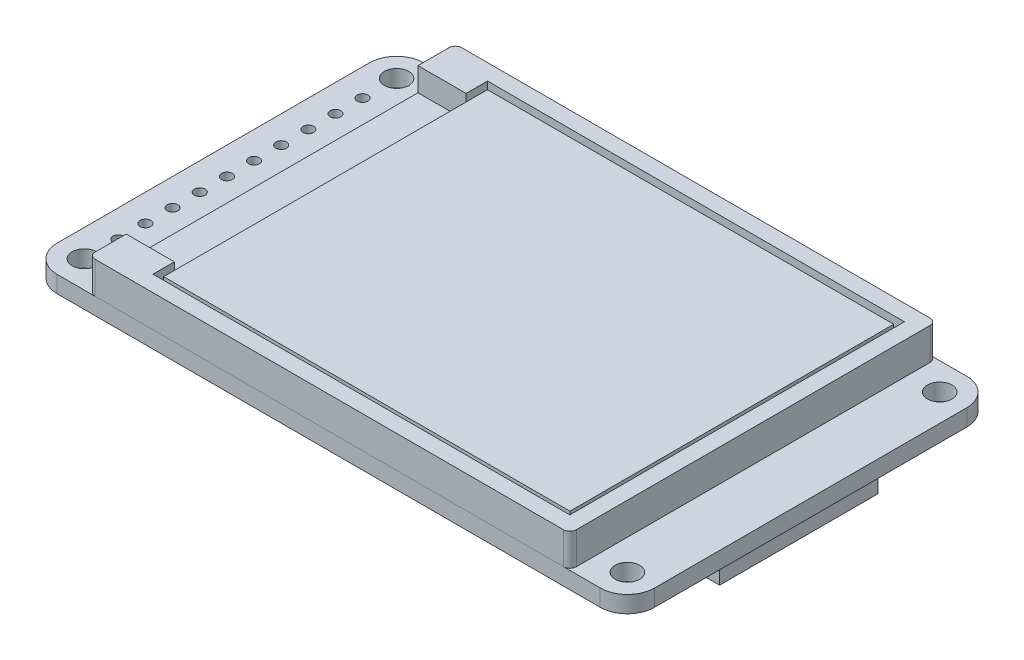
from build123d import *

# Parameters (mm, degrees)
SKETCH1_W                                     = 55.88
SKETCH1_H                                     = 34.29
CIRCUIT_BOARD_DEPTH                           = 1.57
FILLET1_R                                     = 2.54
SKETCH2_R                                     = 1.143
CUT_EXTRUDE1_DEPTH                            = 66.580815792
SKETCH3_R                                     = 0.5
CUT_EXTRUDE2_DEPTH                            = 66.580815792
CONNECTOR_HOLES_COUNT                         = 10
CONNECTOR_HOLES_PITCH                         = 2.54
SKETCH4_W                                     = 7.083224401
SKETCH4_H                                     = 9.821277531
SKETCH4_W_2                                   = 14.273419681
SKETCH4_H_2                                   = 14.821200637
IC1_AND_SD_CARD_SLOT_APPROXIMATE_SIZE_A_DEPTH = 2
SKETCH5_W                                     = 45
SKETCH5_H                                     = 34.29
BOSS_EXTRUDE3_DEPTH                           = 3
CUT_EXTRUDE3_DEPTH                            = 2.2
SKETCH7_W                                     = 38
SKETCH7_H                                     = 30.29
BOSS_EXTRUDE4_DEPTH                           = 2
FILLET2_R                                     = 0.6


with BuildPart() as part:
    # Sketch1 → Circuit Board (new body)
    with BuildSketch(Plane(origin=(0, 0, 0), x_dir=(1, 0, 0), z_dir=(0, 1, 0))):
        with Locations((27.94, 17.145)):
            Rectangle(SKETCH1_W, SKETCH1_H)
    extrude(amount=CIRCUIT_BOARD_DEPTH)

    # Fillet1
    fillet1_edges = [part.edges().sort_by_distance(p)[0] for p in [
        (0, 0.785, -34.29),
        (55.88, 0.785, -34.29),
        (55.88, 0.785, 0),
        (0, 0.785, 0),
    ]]
    fillet(fillet1_edges, radius=FILLET1_R)

    # Sketch2 → Cut-Extrude1 (cut, through all)
    with BuildSketch(Plane(origin=(0, 1.57, 0), x_dir=(1, 0, 0), z_dir=(0, 1, 0))):
        with Locations(Location((2.54, 31.75, 0), (0, 0, 270))):
            Circle(SKETCH2_R)
        with Locations(Location((53.34, 31.75, 0), (0, 0, 270))):
            Circle(SKETCH2_R)
        with Locations(Location((53.34, 2.54, 0), (0, 0, 270))):
            Circle(SKETCH2_R)
        with Locations(Location((2.54, 2.54, 0), (0, 0, 270))):
            Circle(SKETCH2_R)
    extrude(amount=-CUT_EXTRUDE1_DEPTH, mode=Mode.SUBTRACT)

    # Sketch3 → Cut-Extrude2 (cut, through all)
    with BuildSketch(Plane(origin=(0, 1.57, 0), x_dir=(1, 0, 0), z_dir=(0, 1, 0))):
        with Locations(Location((2.54, 5.715, 0), (0, 0, 270))):
            Circle(SKETCH3_R)
    cut_extrude2 = extrude(amount=-CUT_EXTRUDE2_DEPTH, mode=Mode.SUBTRACT)

    # Connector Holes: Cut-Extrude2 ×10
    with Locations(*[(0, 0, -i * CONNECTOR_HOLES_PITCH) for i in range(1, CONNECTOR_HOLES_COUNT)]):
        add(cut_extrude2, mode=Mode.SUBTRACT)

    # Sketch4 → IC1 and SD card slot (approximate size and location) (add)
    with BuildSketch(Plane.XZ):
        with Locations((19.457987587, -17.502137365)):
            Rectangle(SKETCH4_W, SKETCH4_H)
        with Locations((47.993177866, -16.787862636)):
            Rectangle(SKETCH4_W_2, SKETCH4_H_2)
    extrude(amount=IC1_AND_SD_CARD_SLOT_APPROXIMATE_SIZE_A_DEPTH)


with BuildPart() as body_2:
    # Sketch5 → Boss-Extrude3 (new body)
    with BuildSketch(Plane(origin=(0, 1.57, 0), x_dir=(1, 0, 0), z_dir=(0, 1, 0))):
        with Locations((28, 17.145)):
            Rectangle(SKETCH5_W, SKETCH5_H)
    extrude(amount=BOSS_EXTRUDE3_DEPTH)

    # Sketch6 → Cut-Extrude3 (cut)
    with BuildSketch(Plane(origin=(0, 4.57, 0), x_dir=(1, 0, 0), z_dir=(0, 1, 0))):
        Polygon((10, 32.79), (10, 30.79), (5.5, 30.79), (5.5, 3.5), (10, 3.5), (10, 1.5), (49, 1.5), (49, 32.79), align=None)
    extrude(amount=-CUT_EXTRUDE3_DEPTH, mode=Mode.SUBTRACT)

    # Sketch7 → Boss-Extrude4 (add)
    with BuildSketch(Plane(origin=(0, 2.37, 0), x_dir=(1, 0, 0), z_dir=(0, 1, 0))):
        with Locations((29.5, 17.145)):
            Rectangle(SKETCH7_W, SKETCH7_H)
    extrude(amount=BOSS_EXTRUDE4_DEPTH)

    # Fillet2
    fillet2_edges = [body_2.edges().sort_by_distance(p)[0] for p in [
        (5.5, 3.07, -34.29),
        (50.5, 3.07, -34.29),
        (50.5, 3.07, 0),
        (5.5, 3.07, 0),
    ]]
    fillet(fillet2_edges, radius=FILLET2_R)


solid = Compound([part.part, body_2.part])
